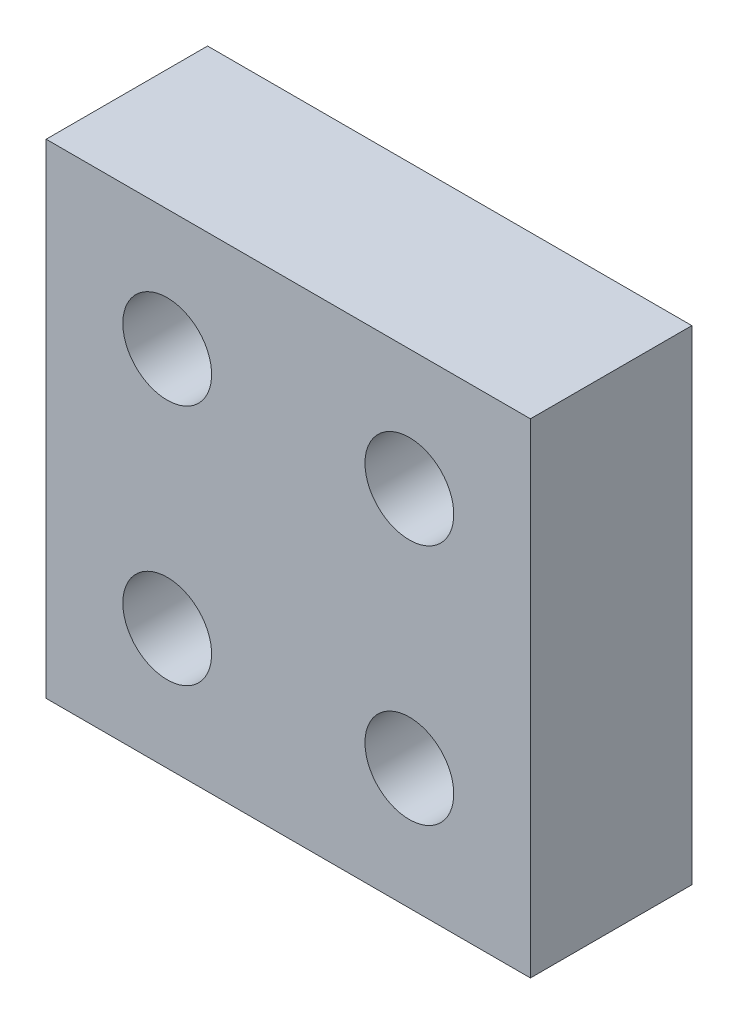
from build123d import *

# Parameters (mm, degrees)
SKETCH1_W           = 24
SKETCH1_H           = 24
SKETCH1_R           = 2.2
BOSS_EXTRUDE1_DEPTH = 8


with BuildPart() as part:
    # Sketch1 → Boss-Extrude1 (new body)
    with BuildSketch(Plane.XY.offset(8)):
        Rectangle(SKETCH1_W, SKETCH1_H)
        with Locations(Location((-6, -6, 0), (0, 0, 180))):
            Circle(SKETCH1_R, mode=Mode.SUBTRACT)
        with Locations(Location((6, 6, 0), (0, 0, 180))):
            Circle(SKETCH1_R, mode=Mode.SUBTRACT)
        with Locations(Location((6, -6, 0), (0, 0, 180))):
            Circle(SKETCH1_R, mode=Mode.SUBTRACT)
        with Locations(Location((-6, 6, 0), (0, 0, 180))):
            Circle(SKETCH1_R, mode=Mode.SUBTRACT)
    extrude(amount=-BOSS_EXTRUDE1_DEPTH)


solid = part.part
